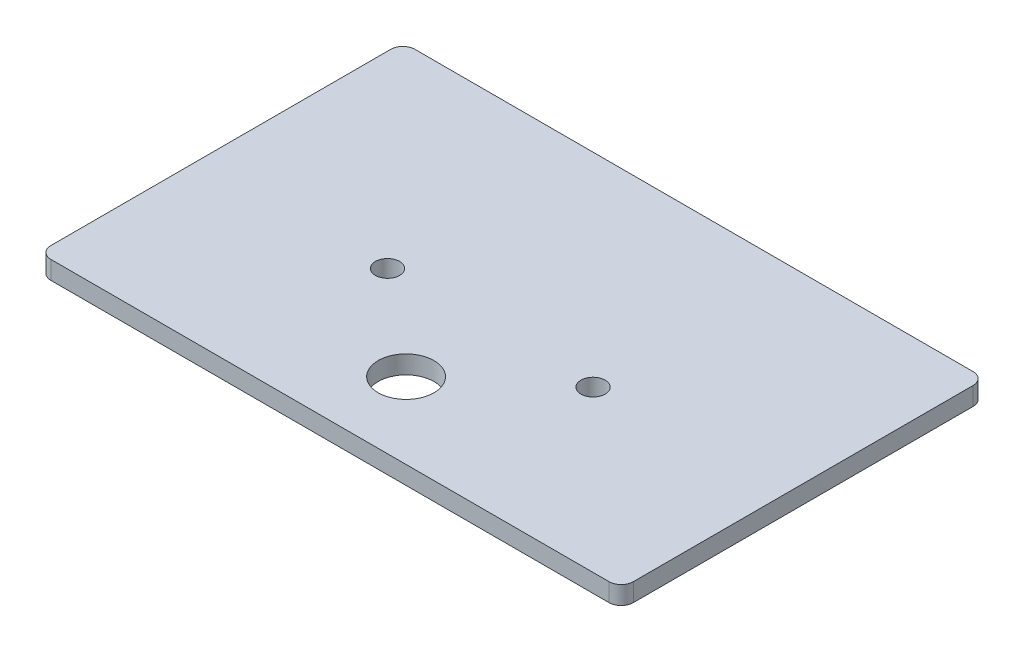
from build123d import *

# Parameters (mm, degrees)
SKETCH1_W           = 72
SKETCH1_H           = 45
BOSS_EXTRUDE1_DEPTH = 2.25
FILLET2_R           = 1.5
FILLET3_R           = 1.5
SKETCH16_R          = 3.45
CUT_EXTRUDE1_DEPTH  = 10
SKETCH18_R          = 1.5
CUT_EXTRUDE2_DEPTH  = 10


with BuildPart() as part:
    # Sketch1 → Boss-Extrude1 (new body)
    with BuildSketch(Plane(origin=(0, 0, 0), x_dir=(1, 0, 0), z_dir=(0, 1, 0))):
        Rectangle(SKETCH1_W, SKETCH1_H)
    extrude(amount=BOSS_EXTRUDE1_DEPTH)

    # Fillet2
    fillet2_edges = [part.edges().sort_by_distance(p)[0] for p in [
        (-36, 1.125, -22.5),
    ]]
    fillet(fillet2_edges, radius=FILLET2_R)

    # Fillet3
    fillet3_edges = [part.edges().sort_by_distance(p)[0] for p in [
        (36, 1.125, 22.5),
        (-36, 1.125, 22.5),
        (36, 1.125, -22.5),
    ]]
    fillet(fillet3_edges, radius=FILLET3_R)

    # Sketch16 → Cut-Extrude1 (cut)
    with BuildSketch(Plane(origin=(0, 2.25, 0), x_dir=(1, 0, 0), z_dir=(0, 1, 0))):
        with Locations(Location((0, -13.097290255, 0), (0, 0, 270))):
            Circle(SKETCH16_R)
    extrude(amount=-CUT_EXTRUDE1_DEPTH, mode=Mode.SUBTRACT)

    # Sketch18 → Cut-Extrude2 (cut)
    with BuildSketch(Plane(origin=(0, 2.25, 0), x_dir=(1, 0, 0), z_dir=(0, 1, 0))):
        with Locations(Location((-12.734859634, -2.656879133, 0), (0, 0, 270))):
            Circle(SKETCH18_R)
        with Locations(Location((12.682272565, -2.656879133, 0), (0, 0, 270))):
            Circle(SKETCH18_R)
    extrude(amount=-CUT_EXTRUDE2_DEPTH, mode=Mode.SUBTRACT)


solid = part.part
